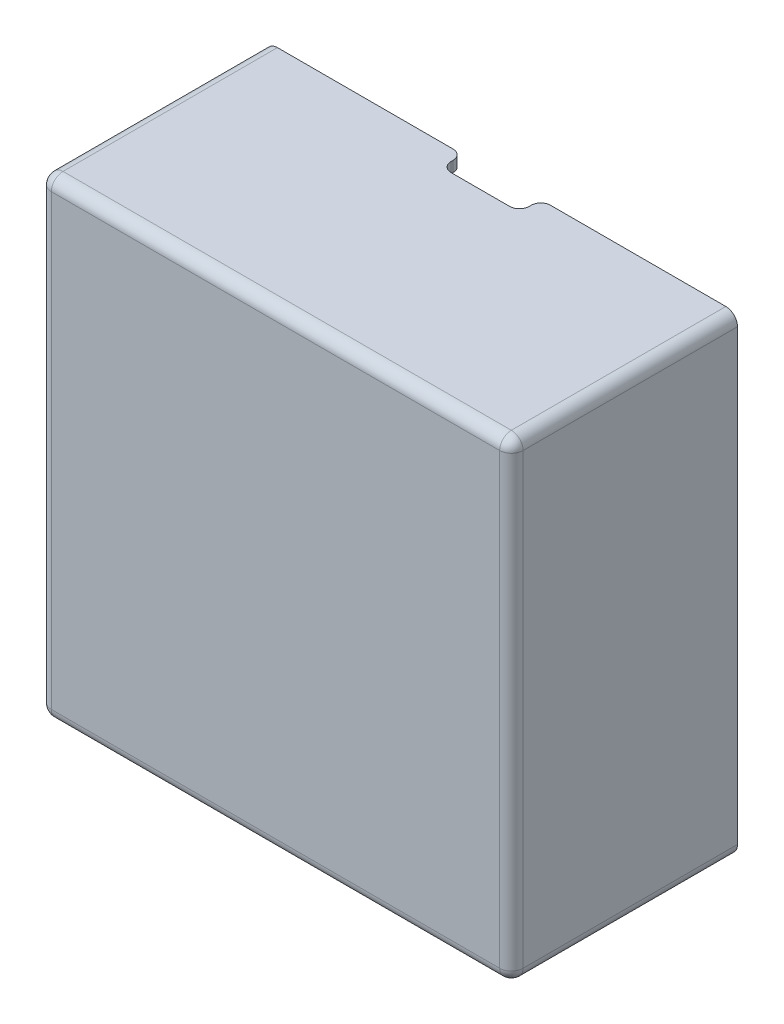
from build123d import *

# Parameters (mm, degrees)
SKETCH1_W           = 121
SKETCH1_H           = 121
SKETCH1_W_2         = 115.5
SKETCH1_H_2         = 115.5
BOSS_EXTRUDE1_DEPTH = 55
SKETCH2_W           = 121
SKETCH2_H           = 121
BOSS_EXTRUDE2_DEPTH = 3
FILLET1_R           = 3
FILLET2_R           = 3
SKETCH3_W           = 20
SKETCH3_H           = 10
CUT_EXTRUDE1_DEPTH  = 177
FILLET3_R           = 2.5
FILLET4_R           = 2.5


with BuildPart() as part:
    # Sketch1 → Boss-Extrude1 (new body)
    with BuildSketch(Plane.XY):
        Rectangle(SKETCH1_W, SKETCH1_H)
        Rectangle(SKETCH1_W_2, SKETCH1_H_2, mode=Mode.SUBTRACT)
    extrude(amount=BOSS_EXTRUDE1_DEPTH)

    # Sketch2 → Boss-Extrude2 (add)
    with BuildSketch(Plane.XY.offset(55)):
        Rectangle(SKETCH2_W, SKETCH2_H)
    extrude(amount=BOSS_EXTRUDE2_DEPTH)

    # Fillet1
    fillet1_edges = [part.edges().sort_by_distance(p)[0] for p in [
        (-57.75, 57.75, 27.5),
        (-57.75, -57.75, 27.5),
        (57.75, -57.75, 27.5),
        (57.75, 57.75, 27.5),
        (-57.75, 0, 55),
        (0, -57.75, 55),
        (57.75, 0, 55),
        (0, 57.75, 55),
    ]]
    fillet(fillet1_edges, radius=FILLET1_R)

    # Fillet2
    fillet2_edges = [part.edges().sort_by_distance(p)[0] for p in [
        (-60.5, 0, 58),
        (0, -60.5, 58),
        (60.5, 0, 58),
        (0, 60.5, 58),
        (-60.5, 60.5, 29),
        (60.5, 60.5, 29),
        (60.5, -60.5, 29),
        (-60.5, -60.5, 29),
    ]]
    fillet(fillet2_edges, radius=FILLET2_R)

    # Sketch3 → Cut-Extrude1 (cut)
    with BuildSketch(Plane.XZ.offset(60.5)):
        with Locations((0.054250772, 0.496011987)):
            Rectangle(SKETCH3_W, SKETCH3_H)
    extrude(amount=-CUT_EXTRUDE1_DEPTH, mode=Mode.SUBTRACT)

    # Fillet3
    fillet3_edges = [part.edges().sort_by_distance(p)[0] for p in [
        (-9.945749228, -59.125, 0),
        (-9.945749228, -59.125, 5.496011987),
        (10.054250772, -59.125, 0),
        (10.054250772, -59.125, 5.496011987),
    ]]
    fillet(fillet3_edges, radius=FILLET3_R)

    # Fillet4
    fillet4_edges = [part.edges().sort_by_distance(p)[0] for p in [
        (-9.945749228, 59.125, 0),
        (-9.945749228, 59.125, 5.496011987),
        (10.054250772, 59.125, 0),
        (10.054250772, 59.125, 5.496011987),
    ]]
    fillet(fillet4_edges, radius=FILLET4_R)


solid = part.part
